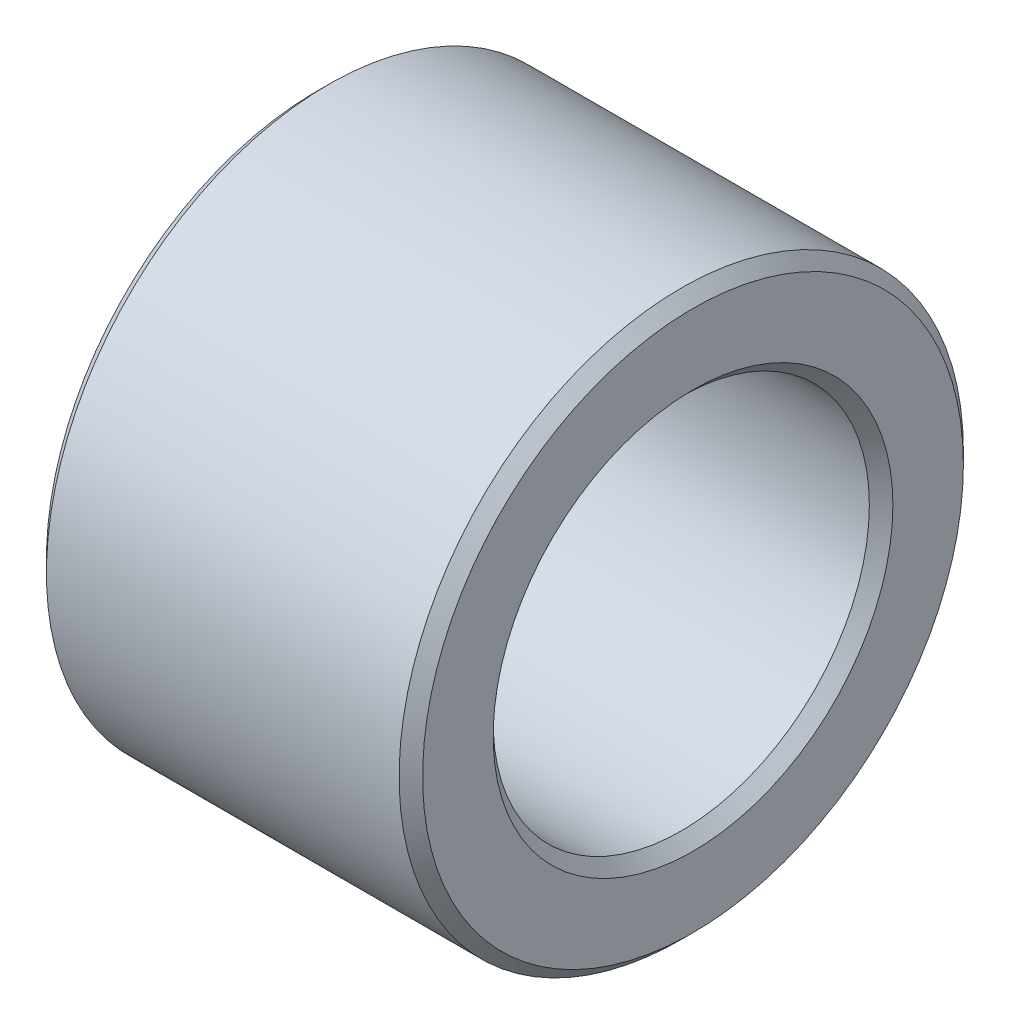
from build123d import *

# Parameters (mm, degrees)
SKETCH1_R           = 6
SKETCH1_R_2         = 4
BOSS_EXTRUDE1_DEPTH = 8
CHAMFER1_SIZE       = 0.25


with BuildPart() as part:
    # Sketch1 → Boss-Extrude1 (new body)
    with BuildSketch(Plane(origin=(0, 0, 0), x_dir=(0, 0, -1), z_dir=(1, 0, 0))):
        Circle(SKETCH1_R)
        Circle(SKETCH1_R_2, mode=Mode.SUBTRACT)
    extrude(amount=BOSS_EXTRUDE1_DEPTH)

    # Chamfer1
    chamfer1_edges = [part.edges().sort_by_distance(p)[0] for p in [
        (0, 0, 6),
        (8, 0, 6),
        (0, 0, 4),
        (8, 0, 4),
    ]]
    chamfer(chamfer1_edges, length=CHAMFER1_SIZE)


solid = part.part
